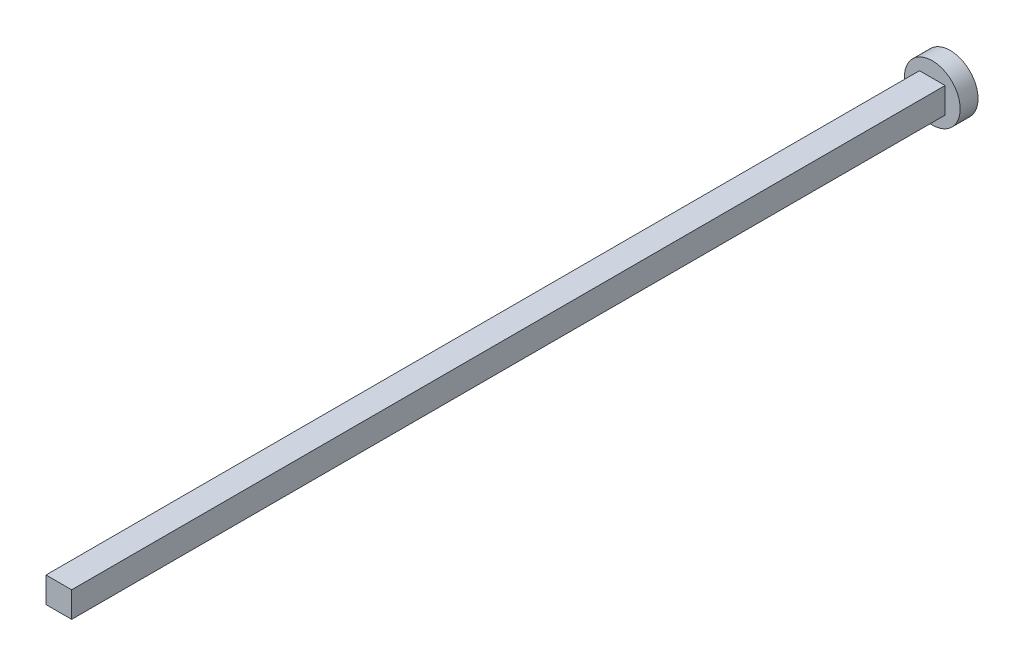
from build123d import *

# Parameters (mm, degrees)
SKETCH1_W           = 2.86759605
SKETCH1_H           = 2.86759605
BOSS_EXTRUDE1_DEPTH = 97.650000052
SKETCH2_R           = 3.116187631
BOSS_EXTRUDE2_DEPTH = 2


with BuildPart() as part:
    # Sketch1 → Boss-Extrude1 (new body)
    with BuildSketch(Plane.XY):
        Rectangle(SKETCH1_W, SKETCH1_H)
    extrude(amount=BOSS_EXTRUDE1_DEPTH)

    # Sketch2 → Boss-Extrude2 (add)
    with BuildSketch(Plane(origin=(0, 0, 0), x_dir=(-1, 0, 0), z_dir=(0, 0, -1))):
        Circle(SKETCH2_R)
    extrude(amount=BOSS_EXTRUDE2_DEPTH)


solid = part.part
